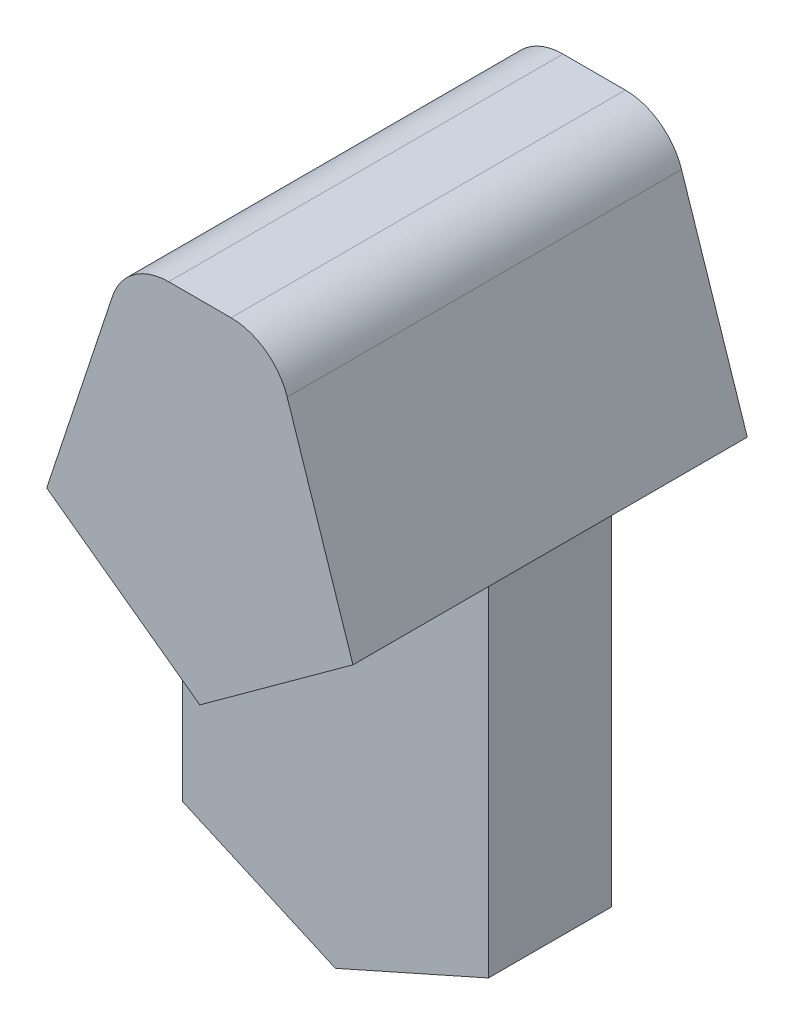
from build123d import *

# Parameters (mm, degrees)
BOSS_EXTRUDE1_DEPTH = 12.7
BOSS_EXTRUDE2_START = -3.583139
SKETCH3_W           = 9.863535196
SKETCH3_H           = 3.96875
BOSS_EXTRUDE2_DEPTH = 13.108139
FILLET1_R           = 1.905
CHAMFER1_SIZE       = 4.92
CHAMFER1_SIZE2      = 2.190525132
SKETCH5_W           = 4.064
SKETCH5_H           = 1.1176
CUT_EXTRUDE2_DEPTH  = 8.255


with BuildPart() as part:
    # Sketch1 → Boss-Extrude1 (new body)
    with BuildSketch(Plane.XY):
        Polygon((0, 0), (-4.931767598, 3.583138898), (-2.38125, 11.30060247), (2.38125, 11.30060247), (4.931767598, 3.583138898), align=None)
    extrude(amount=BOSS_EXTRUDE1_DEPTH)

    # Sketch3 → Boss-Extrude2 (add)
    with BuildSketch(Plane(origin=(0, 0, 0), x_dir=(-1, 0, 0), z_dir=(0, -1, 0)).offset(BOSS_EXTRUDE2_START)):
        with Locations((0, -6.35)):
            Rectangle(SKETCH3_W, SKETCH3_H)
    extrude(amount=BOSS_EXTRUDE2_DEPTH)

    # Fillet1
    fillet1_edges = [part.edges().sort_by_distance(p)[0] for p in [
        (-2.38125, 11.30060247, 6.35),
        (2.38125, 11.30060247, 6.35),
    ]]
    fillet(fillet1_edges, radius=FILLET1_R)

    # Chamfer1
    chamfer1_edges = [part.edges().sort_by_distance(p)[0] for p in [
        (4.931767598, -9.525, 6.35),
        (-4.931767598, -9.525, 6.35),
    ]]
    chamfer1_side = [part.faces().sort_by_distance(p)[0] for p in [
        (0, -9.525, 6.35),
    ]]
    chamfer(chamfer1_edges, length=CHAMFER1_SIZE, length2=CHAMFER1_SIZE2, reference=chamfer1_side[0])

    # Sketch5 → Cut-Extrude2 (cut)
    with BuildSketch(Plane(origin=(0, -9.525, 0), x_dir=(-1, 0, 0), z_dir=(0, -1, 0))):
        with Locations((0, -6.35)):
            Rectangle(SKETCH5_W, SKETCH5_H)
    extrude(amount=-CUT_EXTRUDE2_DEPTH, mode=Mode.SUBTRACT)


solid = part.part
